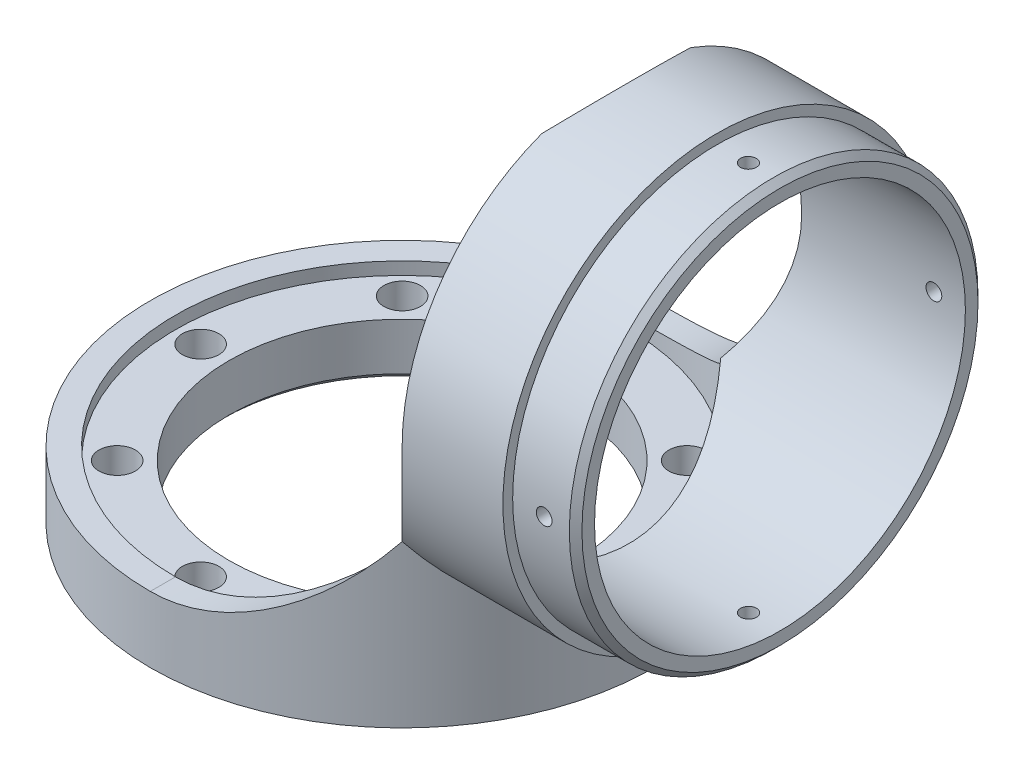
from build123d import *

# Parameters (mm, degrees)
SKETCH_1_R               = 40
SKETCH_1_R_2             = 27.5
EXTRUDE_1_DEPTH          = 80.5
EXTRUDE_3_REACH          = 136.463
EXTRUDE_3_END_RADIUS     = 40
SKETCH_3_R               = 34
SKETCH_20_R              = 2.9
CUT_EXTRUDE_4_DEPTH      = 76.5
CUT_EXTRUDE_5_REACH      = 107.13
SKETCH_23_R              = 1.6
PATTERN_CIRCULAR_5_COUNT = 8
CUT_EXTRUDE_1_DEPTH      = 109.075205464
CUT_EXTRUDE_1_DEPTH_BACK = 109.075205464
CUT_EXTRUDE_2_REACH      = 110.075
SKETCH_17_W              = 97.612789718
SKETCH_17_H              = 80
SKETCH_18_R              = 34
SKETCH_18_R_2            = 32.45
CUT_EXTRUDE_3_DEPTH      = 10
SKETCH_24_R              = 36
CUT_EXTRUDE_6_DEPTH      = 72
CUT_EXTRUDE_7_REACH      = 136.463
SKETCH_26_R              = 29.45
HOLE_WIZARD_M3_1_REACH   = 107.458
HOLE_WIZARD_M3_1_BORE_R  = 1.25
PATTERN_CIRCULAR_6_COUNT = 4
CUT_EXTRUDE_8_DEPTH      = 128.20161179
CHAMFER_1_SIZE           = 1
CHAMFER_2_SIZE           = 1


with BuildPart() as part:
    # 草图1 → 凸台-拉伸1 (new body)
    with BuildSketch(Plane(origin=(0, 0, 0), x_dir=(1, 0, 0), z_dir=(0, 1, 0))):
        with Locations(Location((0, 0, 0), (0, 0, 270))):
            Circle(SKETCH_1_R)
        with Locations(Location((0, 0, 0), (0, 0, 270))):
            Circle(SKETCH_1_R_2, mode=Mode.SUBTRACT)
    extrude(amount=EXTRUDE_1_DEPTH)

    # 凸台-拉伸3: up to this cylinder (the profile starts outside it)
    extrude_3_end = Plane(origin=(0, 44.5, 0), z_dir=(0, -1, 0)) * Cylinder(EXTRUDE_3_END_RADIUS, 353.926, mode=Mode.PRIVATE)
    # 草图3 → 凸台-拉伸3 (add, up to the surface)
    with BuildSketch(Plane(origin=(60, 0, 0), x_dir=(0, 0, -1), z_dir=(1, 0, 0)), mode=Mode.PRIVATE) as extrude_3_sk1:
        with Locations((0, 44.5)):
            Circle(SKETCH_3_R)
    extrude_3_tool1 = extrude(extrude_3_sk1.sketch, amount=-EXTRUDE_3_REACH, mode=Mode.PRIVATE) - extrude_3_end
    add(extrude_3_tool1.solids().sort_by_distance((60, 44.5, 0))[0])

    # 草图20 → 切除-拉伸4 (cut)
    with BuildSketch(Plane(origin=(0, 80.5, 0), x_dir=(1, 0, 0), z_dir=(0, 1, 0))):
        with Locations(Location((32, 0, 0), (0, 0, 270))):
            Circle(SKETCH_20_R)
    cut_extrude_4 = extrude(amount=-CUT_EXTRUDE_4_DEPTH, mode=Mode.SUBTRACT)

    # 草图23 → 切除-拉伸5 (cut, up to next)
    with BuildSketch(Plane(origin=(0, 4, 0), x_dir=(1, 0, 0), z_dir=(0, 1, 0)), mode=Mode.PRIVATE) as cut_extrude_5_sk1:
        with Locations(Location((32, 0, 0), (0, 0, 270))):
            Circle(SKETCH_23_R)
    cut_extrude_5_tool1 = extrude(cut_extrude_5_sk1.sketch, amount=-CUT_EXTRUDE_5_REACH, mode=Mode.PRIVATE) & part.part
    cut_extrude_5 = cut_extrude_5_tool1.solids().sort_by_distance((32, 4, 0))[0]
    add(cut_extrude_5, mode=Mode.SUBTRACT)

    # 阵列(圆周)5: 切除-拉伸4, 切除-拉伸5 ×8 about axis
    pattern_circular_5_axis = Axis((0, 0, 0), (0, 1, 0))
    add([cut_extrude_4.rotate(pattern_circular_5_axis, i * 360 / PATTERN_CIRCULAR_5_COUNT) for i in range(1, PATTERN_CIRCULAR_5_COUNT)], mode=Mode.SUBTRACT)
    add([cut_extrude_5.rotate(pattern_circular_5_axis, i * 360 / PATTERN_CIRCULAR_5_COUNT) for i in range(1, PATTERN_CIRCULAR_5_COUNT)], mode=Mode.SUBTRACT)

    # 草图16 → 切除-拉伸1 (cut, two sides: drawn at the far end of the back side and taken through both)
    with BuildSketch(Plane.XY.offset(-CUT_EXTRUDE_1_DEPTH_BACK)):
        with BuildLine():
            Line((0, 10.5), (-103.390404316, 10.5))
            Line((-103.390404316, 10.5), (-103.390404316, 78.5))
            Line((-103.390404316, 78.5), (0, 78.5))
            ThreePointArc((0, 78.5), (34, 44.5), (0, 10.5))
        make_face()
    extrude(amount=CUT_EXTRUDE_1_DEPTH + CUT_EXTRUDE_1_DEPTH_BACK, mode=Mode.SUBTRACT)

    # 草图17 → 切除-拉伸2 (cut, up to next)
    with BuildSketch(Plane(origin=(0, 80.5, 0), x_dir=(1, 0, 0), z_dir=(0, 1, 0)), mode=Mode.PRIVATE) as cut_extrude_2_sk1:
        with Locations((-14.806394859, 0)):
            Rectangle(SKETCH_17_W, SKETCH_17_H)
    cut_extrude_2_tool1 = extrude(cut_extrude_2_sk1.sketch, amount=-CUT_EXTRUDE_2_REACH, mode=Mode.PRIVATE) & part.part
    add(cut_extrude_2_tool1.solids().sort_by_distance((-14.806395, 80.5, 0))[0], mode=Mode.SUBTRACT)

    # 草图18 → 切除-拉伸3 (cut)
    with BuildSketch(Plane(origin=(60, 0, 0), x_dir=(0, 0, -1), z_dir=(1, 0, 0))):
        with Locations((0, 44.5)):
            Circle(SKETCH_18_R)
        with Locations((0, 44.5)):
            Circle(SKETCH_18_R_2, mode=Mode.SUBTRACT)
    extrude(amount=-CUT_EXTRUDE_3_DEPTH, mode=Mode.SUBTRACT)

    # 草图24 → 切除-拉伸6 (cut)
    with BuildSketch(Plane(origin=(0, 80.5, 0), x_dir=(1, 0, 0), z_dir=(0, 1, 0))):
        with Locations(Location((0, 0, 0), (0, 0, 270))):
            Circle(SKETCH_24_R)
    extrude(amount=-CUT_EXTRUDE_6_DEPTH, mode=Mode.SUBTRACT)

    # 草图26 → 切除-拉伸7 (cut, up to next)
    with BuildSketch(Plane(origin=(60, 0, 0), x_dir=(0, 0, -1), z_dir=(1, 0, 0)), mode=Mode.PRIVATE) as cut_extrude_7_sk1:
        with Locations((0, 44.5)):
            Circle(SKETCH_26_R)
    cut_extrude_7_tool1 = extrude(cut_extrude_7_sk1.sketch, amount=-CUT_EXTRUDE_7_REACH, mode=Mode.PRIVATE) & part.part
    add(cut_extrude_7_tool1.solids().sort_by_distance((60, 44.5, 0))[0], mode=Mode.SUBTRACT)

    # M3 螺纹孔1 bore → M3 螺纹孔1 (cut, up to next)
    with BuildSketch(Plane(origin=(0, 76.95, 0), x_dir=(1, 0, 0), z_dir=(0, 1, 0)), mode=Mode.PRIVATE) as hole_wizard_m3_1_sk1:
        with Locations((55, 0)):
            Circle(HOLE_WIZARD_M3_1_BORE_R)
    hole_wizard_m3_1_tool1 = extrude(hole_wizard_m3_1_sk1.sketch, amount=-HOLE_WIZARD_M3_1_REACH, mode=Mode.PRIVATE) & part.part
    hole_wizard_m3_1 = hole_wizard_m3_1_tool1.solids().sort_by_distance((55, 76.95, 0))[0]
    add(hole_wizard_m3_1, mode=Mode.SUBTRACT)

    # 阵列(圆周)6: M3 螺纹孔1 ×4 about axis
    pattern_circular_6_axis = Axis((50, 44.5, 0), (1, 0, 0))
    for i in range(1, PATTERN_CIRCULAR_6_COUNT):
        add(hole_wizard_m3_1.rotate(pattern_circular_6_axis, i * 360 / PATTERN_CIRCULAR_6_COUNT), mode=Mode.SUBTRACT)

    # 草图31 → 切除-拉伸8 (cut, through all)
    with BuildSketch(Plane(origin=(50, 0, 0), x_dir=(0, 0, -1), z_dir=(1, 0, 0))):
        with BuildLine():
            Line((-21.071307506, 80.5), (-21.071307506, 71.183328128))
            ThreePointArc((-21.071307506, 71.183328128), (0, 78.5), (21.071307506, 71.183328128))
            Line((21.071307506, 71.183328128), (21.071307506, 80.5))
            Line((21.071307506, 80.5), (-21.071307506, 80.5))
        make_face()
    extrude(amount=-CUT_EXTRUDE_8_DEPTH, mode=Mode.SUBTRACT)

    # 倒角1
    chamfer_1_edges = [part.edges().sort_by_distance(p)[0] for p in [
        (60, 44.5, 32.45),
    ]]
    chamfer(chamfer_1_edges, length=CHAMFER_1_SIZE)

    # 倒角2
    chamfer_2_edges = [part.edges().sort_by_distance(p)[0] for p in [
        (0, 0, -27.5),
    ]]
    chamfer(chamfer_2_edges, length=CHAMFER_2_SIZE)


solid = part.part
